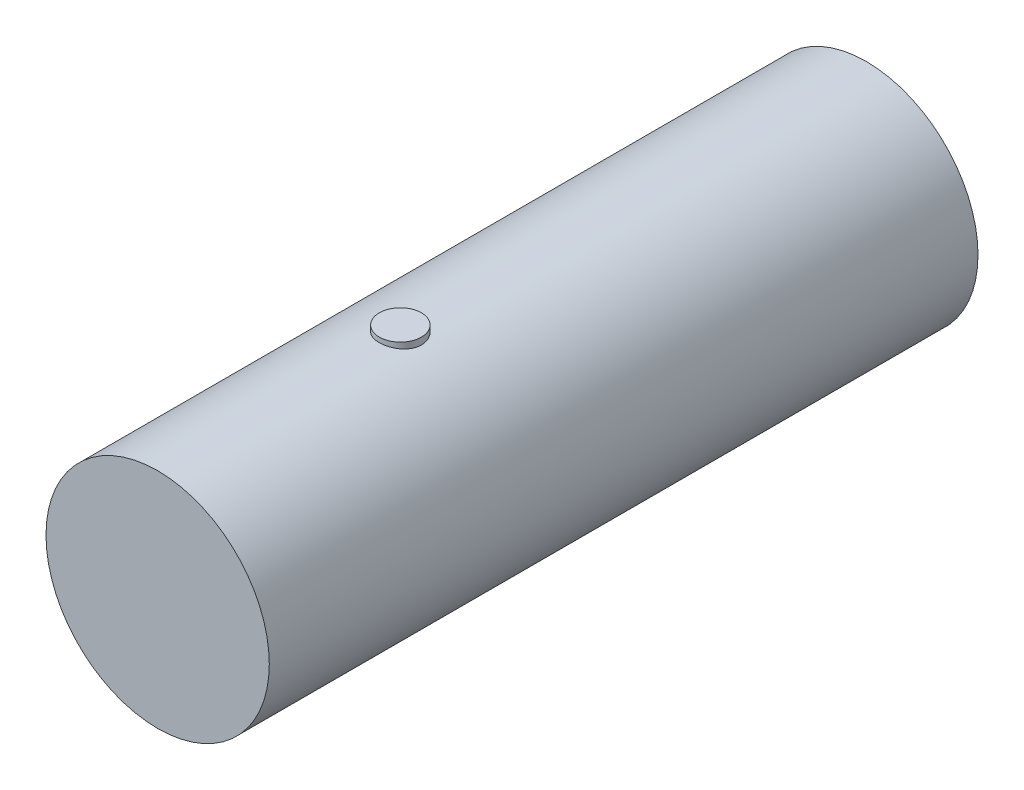
from build123d import *

# Parameters (mm, degrees)
SKIZZE1_R                            = 115
AUFSATZ_LINEAR_AUSTRAGEN1_DEPTH      = 730
AUFSATZ_LINEAR_AUSTRAGEN2_DEPTH      = 120
AUFSATZ_LINEAR_AUSTRAGEN2_DEPTH_BACK = 120
SKIZZE2_R                            = 21.686343762


with BuildPart() as part:
    # Skizze1 → Aufsatz-Linear austragen1 (new body)
    with BuildSketch(Plane.XY):
        Circle(SKIZZE1_R)
    extrude(amount=AUFSATZ_LINEAR_AUSTRAGEN1_DEPTH)

    # Skizze2 → Aufsatz-Linear austragen2 (add, two sides: drawn at the far end of the back side and taken through both)
    with BuildSketch(Plane(origin=(0, 0, 0), x_dir=(1, 0, 0), z_dir=(0, 1, 0)).offset(-AUFSATZ_LINEAR_AUSTRAGEN2_DEPTH_BACK)):
        with Locations((0, -480)):
            Circle(SKIZZE2_R)
    extrude(amount=AUFSATZ_LINEAR_AUSTRAGEN2_DEPTH + AUFSATZ_LINEAR_AUSTRAGEN2_DEPTH_BACK)


solid = part.part
